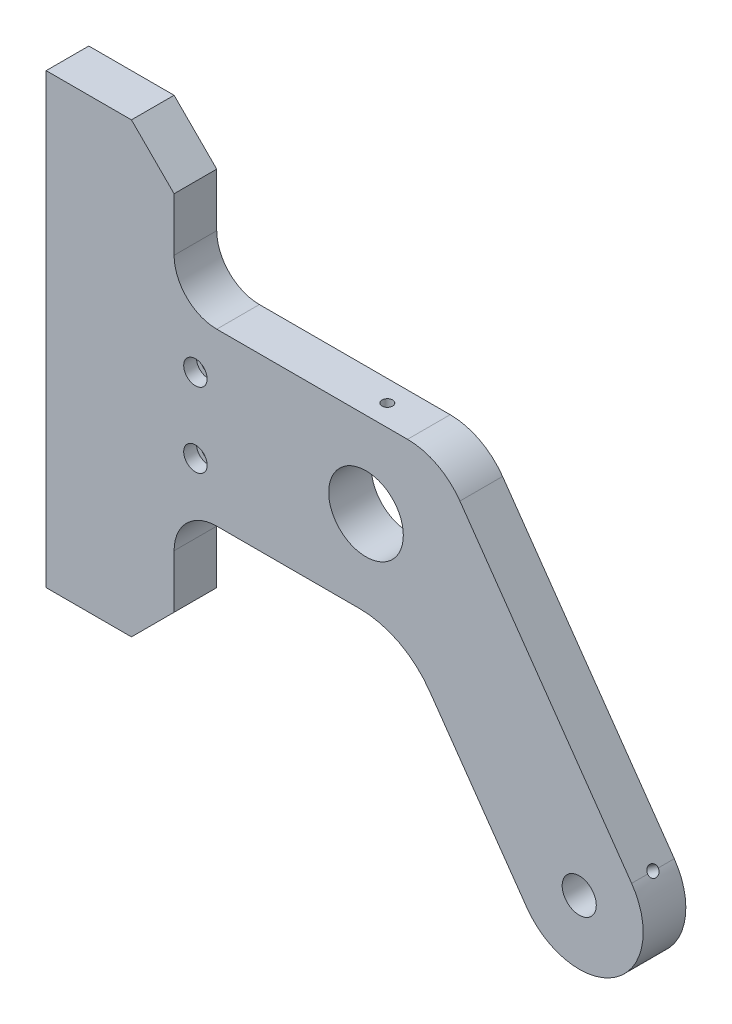
from build123d import *

# Parameters (mm, degrees)
EXTRUDE_1_DEPTH              = 10
CHAMFER_1_SIZE               = 20
FILLET_1_R                   = 20
FILLET_2_R                   = 30
FILLET_3_R                   = 40
HOLE_WIZARD_M10_1_D          = 8.5
HOLE_WIZARD_M10_1_DEPTH      = 25
HOLE_WIZARD_M10_1_TIP        = 2.553657631
HOLE_WIZARD_M6_1_D           = 6.5
HOLE_WIZARD_M6_1_CBORE_D     = 11
HOLE_WIZARD_M6_1_CBORE_DEPTH = 6
HOLE_WIZARD_1_D              = 35
HOLE_WIZARD_2_D              = 16
HOLE_WIZARD_2_DEPTH          = 38
HOLE_WIZARD_M6_1_2_D         = 5
HOLE_WIZARD_M6_1_2_DEPTH     = 15
HOLE_WIZARD_M6_1_2_TIP       = 1.502151548
HOLE_WIZARD_M6_2_D           = 5
HOLE_WIZARD_M6_2_DEPTH       = 15
HOLE_WIZARD_M6_2_TIP         = 1.502151548


with BuildPart() as part:
    # 草图1 → 凸台-拉伸1 (new, symmetric)
    with BuildSketch(Plane.XY):
        with BuildLine():
            Line((0, 210), (60, 210))
            Line((60, 210), (60, 145))
            Line((60, 145), (185.093144622, 145))
            Line((185.093144622, 145), (274.574561329, 17.207293091))
            ThreePointArc((274.574561329, 17.207293091), (267.207293091, -24.574561329), (225.425438671, -17.207293091))
            Line((225.425438671, -17.207293091), (167.863272354, 65))
            Line((167.863272354, 65), (60, 65))
            Line((60, 65), (60, 0))
            Line((60, 0), (0, 0))
            Line((0, 0), (0, 210))
        make_face()
    extrude(amount=EXTRUDE_1_DEPTH, both=True)

    # 倒角1
    chamfer_1_edges = [part.edges().sort_by_distance(p)[0] for p in [
        (60, 0, 0),
        (60, 210, 0),
    ]]
    chamfer(chamfer_1_edges, length=CHAMFER_1_SIZE)

    # 圆角1
    fillet_1_edges = [part.edges().sort_by_distance(p)[0] for p in [
        (60, 145, 0),
        (60, 65, 0),
    ]]
    fillet(fillet_1_edges, radius=FILLET_1_R)

    # 圆角2
    fillet_2_edges = [part.edges().sort_by_distance(p)[0] for p in [
        (185.093144622, 145, 0),
    ]]
    fillet(fillet_2_edges, radius=FILLET_2_R)

    # 圆角3
    fillet_3_edges = [part.edges().sort_by_distance(p)[0] for p in [
        (167.863272354, 65, 0),
    ]]
    fillet(fillet_3_edges, radius=FILLET_3_R)

    # M10 螺纹孔1
    with Locations(Plane.ZY):
        with Locations((0, 195), (0, 135), (0, 75), (0, 15)):
            Hole(HOLE_WIZARD_M10_1_D / 2, depth=HOLE_WIZARD_M10_1_DEPTH)
            with Locations((0, 0, -(HOLE_WIZARD_M10_1_DEPTH + HOLE_WIZARD_M10_1_TIP / 2))):  # 118° drill point
                Cone(0, HOLE_WIZARD_M10_1_D / 2, HOLE_WIZARD_M10_1_TIP, mode=Mode.SUBTRACT)

    # Hole Wizard M6 _1 (through all)
    with Locations(Plane.XY.offset(10)):
        with Locations((70, 122.5), (70, 87.5)):
            CounterBoreHole(HOLE_WIZARD_M6_1_D / 2, HOLE_WIZARD_M6_1_CBORE_D / 2, HOLE_WIZARD_M6_1_CBORE_DEPTH)

    # 孔1 (through all)
    with Locations(Plane.XY.offset(10)):
        with Locations((150, 105)):
            Hole(HOLE_WIZARD_1_D / 2)

    # 孔2
    with Locations(Plane.XY.offset(10)):
        with Locations((250, 0)):
            Hole(HOLE_WIZARD_2_D / 2, depth=HOLE_WIZARD_2_DEPTH)

    # Hole Wizard M6 _1 2
    with Locations(Plane(origin=(0, 145, 0), x_dir=(-1, 0, 0), z_dir=(0, 1, 0))):
        with Locations((-150, 0)):
            Hole(HOLE_WIZARD_M6_1_2_D / 2, depth=HOLE_WIZARD_M6_1_2_DEPTH)
            with Locations((0, 0, -(HOLE_WIZARD_M6_1_2_DEPTH + HOLE_WIZARD_M6_1_2_TIP / 2))):  # 118° drill point
                Cone(0, HOLE_WIZARD_M6_1_2_D / 2, HOLE_WIZARD_M6_1_2_TIP, mode=Mode.SUBTRACT)

    # M6 螺纹孔2
    with Locations(Plane(origin=(192.327079244, 134.668870689, 0), x_dir=(0, 0, -1), z_dir=(0.8191520442889934, 0.573576436351044, 0))):
        with Locations((0, -143.394109088)):
            Hole(HOLE_WIZARD_M6_2_D / 2, depth=HOLE_WIZARD_M6_2_DEPTH)
            with Locations((0, 0, -(HOLE_WIZARD_M6_2_DEPTH + HOLE_WIZARD_M6_2_TIP / 2))):  # 118° drill point
                Cone(0, HOLE_WIZARD_M6_2_D / 2, HOLE_WIZARD_M6_2_TIP, mode=Mode.SUBTRACT)


solid = part.part
